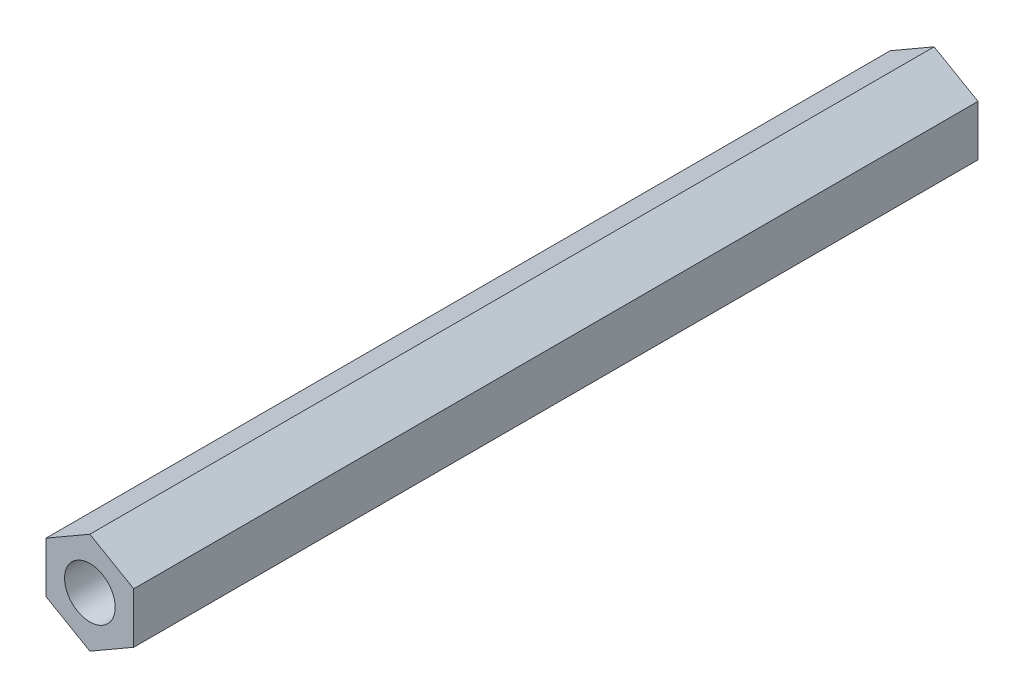
from build123d import *

# Parameters (mm, degrees)
SKETCH_1_R      = 1.5
EXTRUDE_1_DEPTH = 50


with BuildPart() as part:
    # 草图1 → 凸台-拉伸1 (new body)
    with BuildSketch(Plane.XY):
        Polygon((-12.95849367, 63.688556528), (-10.360417458, 65.188556528), (-10.360417458, 68.188556528), (-12.95849367, 69.688556528), (-15.556569881, 68.188556528), (-15.556569881, 65.188556528), align=None)
        with Locations((-12.95849367, 66.688556528)):
            Circle(SKETCH_1_R, mode=Mode.SUBTRACT)
    extrude(amount=EXTRUDE_1_DEPTH)


solid = part.part
